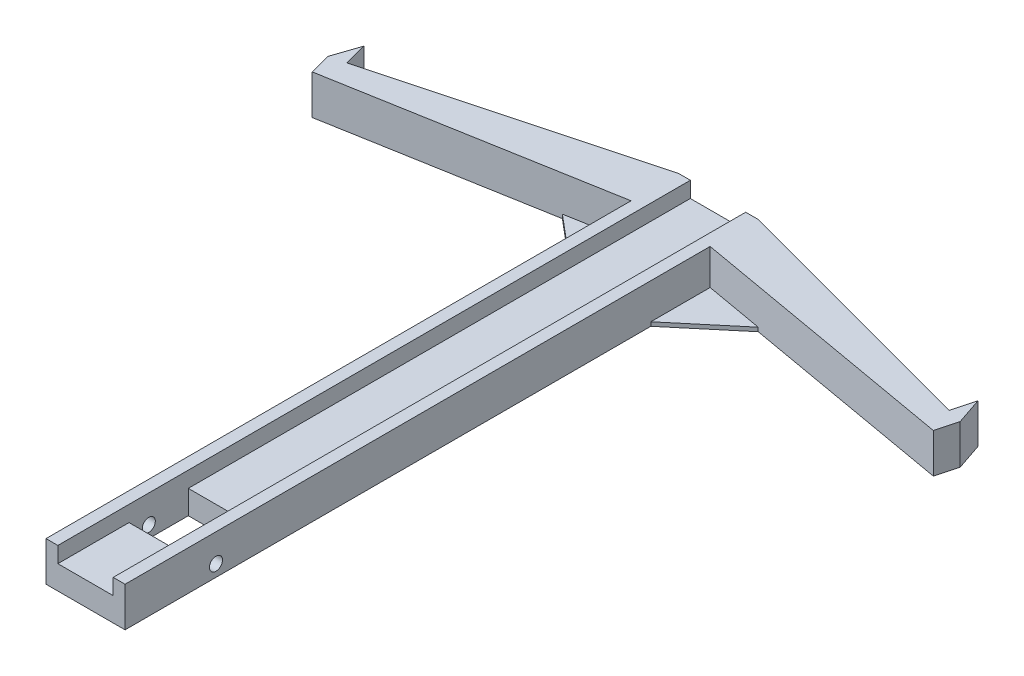
from build123d import *

# Parameters (mm, degrees)
BOSS_EXTRUDE1_DEPTH     = 10
SKETCH2_W               = 14
SKETCH2_H               = 160
CUT_EXTRUDE1_DEPTH      = 4
BOSS_EXTRUDE2_DEPTH     = 10
SKETCH4_W               = 14
SKETCH4_H               = 15
CUT_EXTRUDE2_DEPTH      = 10
CUT_EXTRUDE3_DEPTH      = 20
CUT_EXTRUDE3_DEPTH_BACK = 10
SKETCH5_R               = 1.65
BOSS_EXTRUDE3_DEPTH     = 1


with BuildPart() as part:
    # Sketch1 → Boss-Extrude1 (new body)
    with BuildSketch(Plane(origin=(0, 0, 0), x_dir=(1, 0, 0), z_dir=(0, 1, 0))):
        Polygon((-10, 80), (-80, 61.24355653), (-78.570648621, 55.909144563), (-10, 68), (-10, -80), (10, -80), (10, 68), (78.570648621, 55.909144563), (80, 61.24355653), (10, 80), align=None)
    extrude(amount=BOSS_EXTRUDE1_DEPTH)

    # Sketch2 → Cut-Extrude1 (cut)
    with BuildSketch(Plane(origin=(0, 10, 0), x_dir=(1, 0, 0), z_dir=(0, 1, 0))):
        Rectangle(SKETCH2_W, SKETCH2_H)
    extrude(amount=-CUT_EXTRUDE1_DEPTH, mode=Mode.SUBTRACT)

    # Sketch3 → Boss-Extrude2 (add)
    with BuildSketch(Plane(origin=(0, 10, 0), x_dir=(1, 0, 0), z_dir=(0, 1, 0))):
        Polygon((77.689210965, 68.074387668), (76.136296695, 62.27883271), (80, 61.24355653), align=None)
        Polygon((-77.689210965, 68.074387668), (-76.136296695, 62.27883271), (-80, 61.24355653), align=None)
    extrude(amount=-BOSS_EXTRUDE2_DEPTH)

    # Sketch4 → Cut-Extrude2 (cut)
    with BuildSketch(Plane(origin=(0, 6, 0), x_dir=(1, 0, 0), z_dir=(0, 1, 0))):
        with Locations((0, -54.5)):
            Rectangle(SKETCH4_W, SKETCH4_H)
    extrude(amount=-CUT_EXTRUDE2_DEPTH, mode=Mode.SUBTRACT)

    # Sketch5 → Cut-Extrude3 (cut, two sides: drawn at the far end of the back side and taken through both)
    with BuildSketch(Plane.ZY.offset(-7).offset(-CUT_EXTRUDE3_DEPTH_BACK)):
        with Locations(Location((57, 3, 0), (0, 0, 180))):
            Circle(SKETCH5_R)
    extrude(amount=CUT_EXTRUDE3_DEPTH + CUT_EXTRUDE3_DEPTH_BACK, mode=Mode.SUBTRACT)

    # Sketch6 → Boss-Extrude3 (add)
    with BuildSketch(Plane.XZ):
        Polygon((-24.772116295, -65.395277335), (-10, -53), (-10, -68), align=None)
        Polygon((10, -53), (24.772116295, -65.395277335), (10, -68), align=None)
    extrude(amount=-BOSS_EXTRUDE3_DEPTH)


solid = part.part
